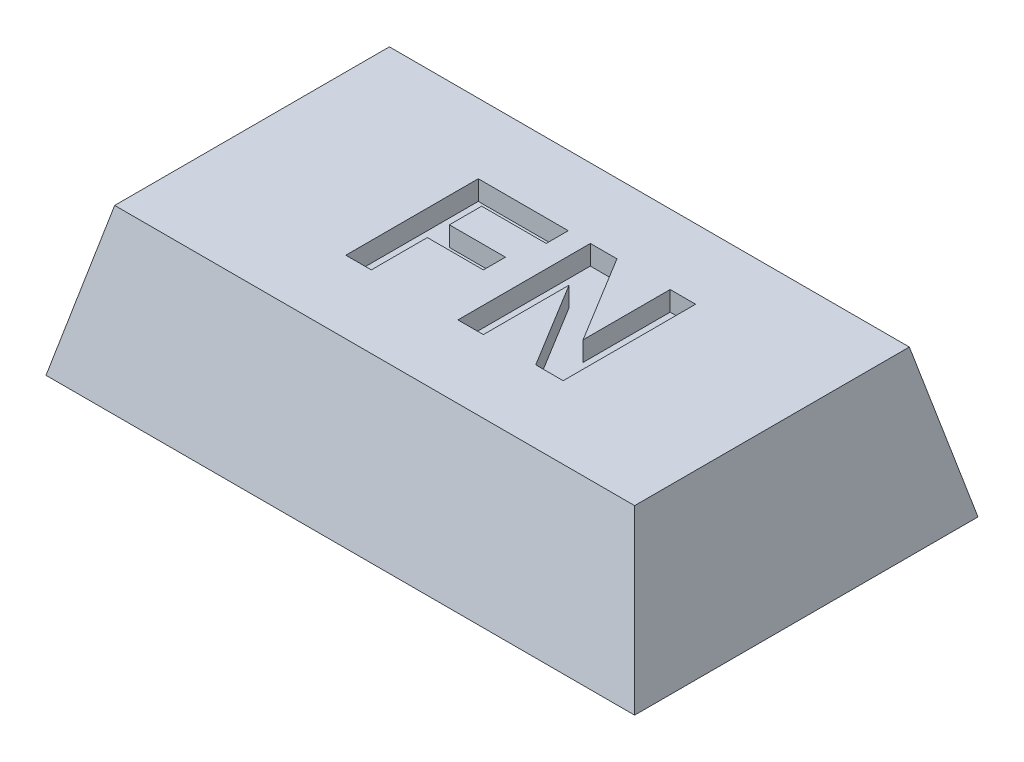
from build123d import *

# Parameters (mm, degrees)
SKETCH1_W               = 12
SKETCH1_H               = 7
BOSS_EXTRUDE1_DEPTH     = 3
CUT_EXTRUDE1_DEPTH      = 7
CUT_EXTRUDE2_DEPTH      = 15.212670404
CUT_EXTRUDE2_DEPTH_BACK = 15.212670404
SKETCH4_R               = 1.8
CUT_EXTRUDE3_DEPTH      = 0.8
CUT_EXTRUDE4_DEPTH      = 0.4


with BuildPart() as part:
    # Sketch1 → Boss-Extrude1 (new body)
    with BuildSketch(Plane(origin=(0, 0, 0), x_dir=(1, 0, 0), z_dir=(0, 1, 0))):
        with Locations((6, 3.5)):
            Rectangle(SKETCH1_W, SKETCH1_H)
    extrude(amount=BOSS_EXTRUDE1_DEPTH)

    # Sketch2 → Cut-Extrude1 (cut)
    with BuildSketch(Plane.XY):
        Polygon((0, 0), (0.7, 3), (0, 3), align=None)
        Polygon((12, 0), (11.3, 3), (12, 3), align=None)
    extrude(amount=-CUT_EXTRUDE1_DEPTH, mode=Mode.SUBTRACT)

    # Sketch3 → Cut-Extrude2 (cut, two sides: drawn at the far end of the back side and taken through both)
    with BuildSketch(Plane(origin=(0, 0, 0), x_dir=(0, 0, -1), z_dir=(1, 0, 0)).offset(-CUT_EXTRUDE2_DEPTH_BACK)):
        Polygon((0, 0), (0.7, 3), (0, 3), align=None)
        Polygon((7, 3), (6.3, 3), (7, 0), align=None)
    extrude(amount=CUT_EXTRUDE2_DEPTH + CUT_EXTRUDE2_DEPTH_BACK, mode=Mode.SUBTRACT)

    # Sketch4 → Cut-Extrude3 (cut)
    with BuildSketch(Plane.XZ):
        with Locations(Location((6, -3.5, 0), (0, 0, 270))):
            Circle(SKETCH4_R)
    extrude(amount=-CUT_EXTRUDE3_DEPTH, mode=Mode.SUBTRACT)

    # Sketch5 → Cut-Extrude4 (cut)
    with BuildSketch(Plane(origin=(0, 3, 0), x_dir=(1, 0, 0), z_dir=(0, 1, 0))):
        Polygon((3.935252413, 2.177234373), (3.935252413, 4.877234373), (5.769867798, 4.877234373), (5.769867798, 4.427234373), (4.454483182, 4.427234373), (4.454483182, 3.769542065), (5.596790874, 3.769542065), (5.596790874, 3.319542065), (4.454483182, 3.319542065), (4.454483182, 2.177234373), align=None)
        Polygon((6.219867798, 2.177234373), (6.219867798, 4.877234373), (6.762355778, 4.877234373), (7.846790874, 3.102114181), (7.846790874, 4.877234373), (8.366021644, 4.877234373), (8.366021644, 2.177234373), (7.806766836, 2.177234373), (6.739098567, 3.924229565), (6.739098567, 2.177234373), align=None)
    extrude(amount=-CUT_EXTRUDE4_DEPTH, mode=Mode.SUBTRACT)


solid = part.part
